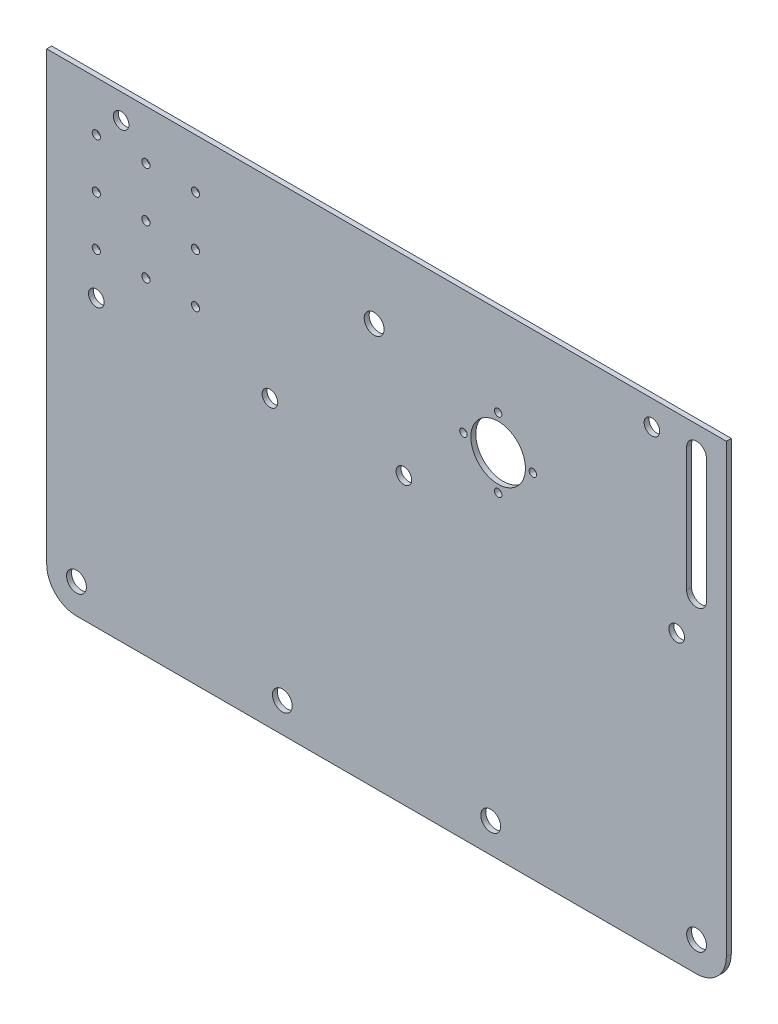
from build123d import *

# Parameters (mm, degrees)
SKETCH1_R           = 4
SKETCH1_R_2         = 3.15
SKETCH1_R_3         = 1.65
SKETCH1_R_4         = 1.5
SKETCH1_R_5         = 11
BOSS_EXTRUDE1_DEPTH = 2


with BuildPart() as part:
    # Sketch1 → Boss-Extrude1 (new body)
    with BuildSketch(Plane.XY):
        with BuildLine():
            ThreePointArc((-137, 0), (-133.485281374, -8.485281374), (-125, -12))
            Line((-125, -12), (125, -12))
            ThreePointArc((125, -12), (133.485281374, -8.485281374), (137, 0))
            Line((137, 0), (137, 180))
            Line((137, 180), (-53.998245329, 180))
            Line((-53.998245329, 180), (-137, 180))
            Line((-137, 180), (-137, 0))
        make_face()
        with Locations((-125, 0)):
            Circle(SKETCH1_R, mode=Mode.SUBTRACT)
        with Locations((-42, 0)):
            Circle(SKETCH1_R, mode=Mode.SUBTRACT)
        with Locations((42, 0)):
            Circle(SKETCH1_R, mode=Mode.SUBTRACT)
        with Locations((125, 0)):
            Circle(SKETCH1_R, mode=Mode.SUBTRACT)
        with Locations((-117, 103)):
            Circle(SKETCH1_R_2, mode=Mode.SUBTRACT)
        with Locations((-117, 120)):
            Circle(SKETCH1_R_3, mode=Mode.SUBTRACT)
        with Locations((-97, 120)):
            Circle(SKETCH1_R_3, mode=Mode.SUBTRACT)
        with Locations((-77, 120)):
            Circle(SKETCH1_R_3, mode=Mode.SUBTRACT)
        with Locations((-47, 103)):
            Circle(SKETCH1_R_2, mode=Mode.SUBTRACT)
        with Locations((-117, 140)):
            Circle(SKETCH1_R_3, mode=Mode.SUBTRACT)
        with Locations((-97, 140)):
            Circle(SKETCH1_R_3, mode=Mode.SUBTRACT)
        with Locations((-77, 140)):
            Circle(SKETCH1_R_3, mode=Mode.SUBTRACT)
        with Locations((-117, 160)):
            Circle(SKETCH1_R_3, mode=Mode.SUBTRACT)
        with Locations((-107, 170)):
            Circle(SKETCH1_R_2, mode=Mode.SUBTRACT)
        with Locations((-97, 160)):
            Circle(SKETCH1_R_3, mode=Mode.SUBTRACT)
        with Locations((-77, 160)):
            Circle(SKETCH1_R_3, mode=Mode.SUBTRACT)
        with Locations((-5, 150)):
            Circle(SKETCH1_R, mode=Mode.SUBTRACT)
        with Locations((7, 103)):
            Circle(SKETCH1_R_2, mode=Mode.SUBTRACT)
        with Locations((31, 130)):
            Circle(SKETCH1_R_4, mode=Mode.SUBTRACT)
        with Locations((45, 116)):
            Circle(SKETCH1_R_4, mode=Mode.SUBTRACT)
        with Locations((45, 130)):
            Circle(SKETCH1_R_5, mode=Mode.SUBTRACT)
        with Locations((59, 130)):
            Circle(SKETCH1_R_4, mode=Mode.SUBTRACT)
        with Locations((117, 103)):
            Circle(SKETCH1_R_2, mode=Mode.SUBTRACT)
        with Locations((45, 144)):
            Circle(SKETCH1_R_4, mode=Mode.SUBTRACT)
        with BuildLine():
            ThreePointArc((129, 120), (125, 116), (121, 120))
            Line((121, 120), (121, 170))
            ThreePointArc((121, 170), (125, 174), (129, 170))
            Line((129, 170), (129, 120))
        make_face(mode=Mode.SUBTRACT)
        with Locations((107, 170)):
            Circle(SKETCH1_R_2, mode=Mode.SUBTRACT)
    extrude(amount=BOSS_EXTRUDE1_DEPTH)


solid = part.part
